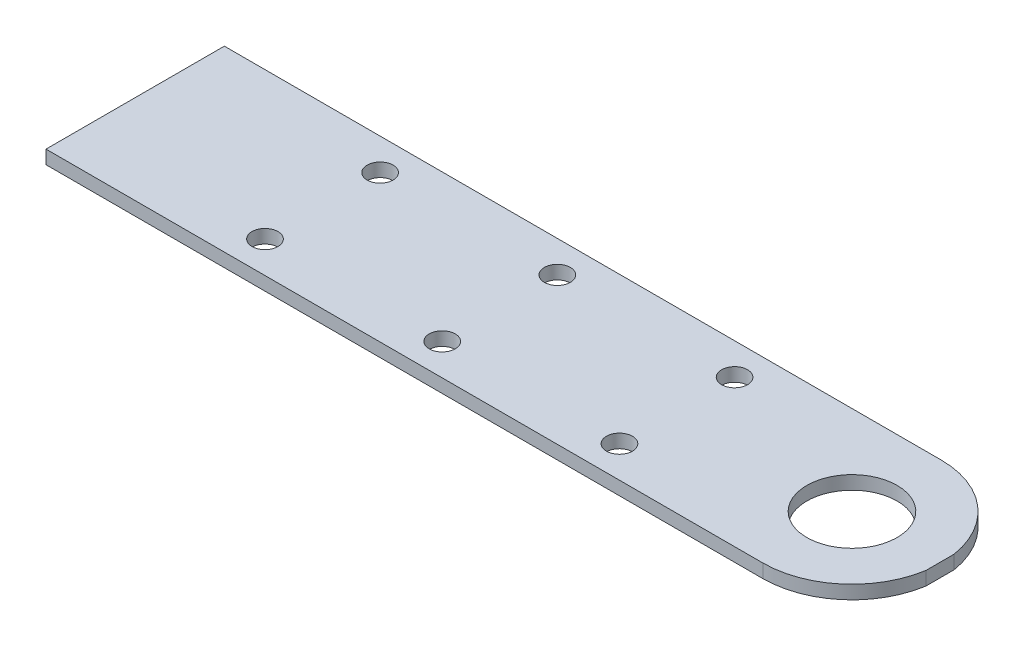
from build123d import *

# Parameters (mm, degrees)
SKETCH1_R           = 1.4605
SKETCH1_R_2         = 5.08
BOSS_EXTRUDE1_DEPTH = 1.524


with BuildPart() as part:
    # Sketch1 → Boss-Extrude1 (new body)
    with BuildSketch(Plane(origin=(0, 0, 0), x_dir=(1, 0, 0), z_dir=(0, 1, 0))):
        with BuildLine():
            Line((-90.551, 0), (-9.906, 0))
            ThreePointArc((-9.906, 0), (-3.398484286, 2.396683595), (0, 8.441694561))
            Line((0, 8.441694561), (0, 11.624305439))
            ThreePointArc((0, 11.624305439), (-3.398484286, 17.669316405), (-9.906, 20.066))
            Line((-9.906, 20.066), (-90.551, 20.066))
            Line((-90.551, 20.066), (-90.551, 0))
        make_face()
        with Locations(Location((-69.469, 3.556, 0), (0, 0, 90))):
            Circle(SKETCH1_R, mode=Mode.SUBTRACT)
        with Locations(Location((-49.53, 3.556, 0), (0, 0, 90))):
            Circle(SKETCH1_R, mode=Mode.SUBTRACT)
        with Locations(Location((-29.591, 3.556, 0), (0, 0, 90))):
            Circle(SKETCH1_R, mode=Mode.SUBTRACT)
        with Locations(Location((-69.469, 16.51, 0), (0, 0, 90))):
            Circle(SKETCH1_R, mode=Mode.SUBTRACT)
        with Locations(Location((-49.53, 16.51, 0), (0, 0, 90))):
            Circle(SKETCH1_R, mode=Mode.SUBTRACT)
        with Locations(Location((-9.906, 10.033, 0), (0, 0, 90))):
            Circle(SKETCH1_R_2, mode=Mode.SUBTRACT)
        with Locations(Location((-29.591, 16.51, 0), (0, 0, 90))):
            Circle(SKETCH1_R, mode=Mode.SUBTRACT)
    extrude(amount=BOSS_EXTRUDE1_DEPTH)


solid = part.part
